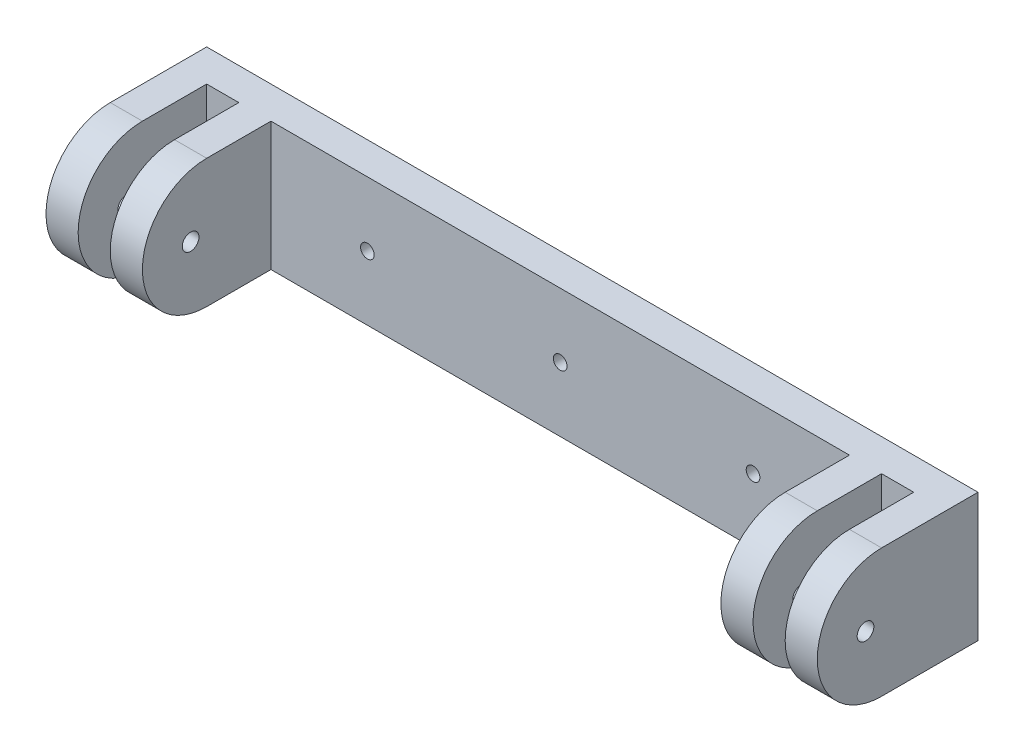
from build123d import *

# Parameters (mm, degrees)
SKETCH1_W           = 240
SKETCH1_H           = 40
BOSS_EXTRUDE1_DEPTH = 10
SKETCH2_W           = 20
SKETCH2_H           = 40
BOSS_EXTRUDE2_DEPTH = 240
SKETCH3_R           = 2.6
CUT_EXTRUDE1_DEPTH  = 300
SKETCH4_W           = 10
SKETCH4_H           = 40
SKETCH4_W_2         = 180
CUT_EXTRUDE2_DEPTH  = 300
SKETCH5_R           = 2.125
CUT_EXTRUDE3_DEPTH  = 300


with BuildPart() as part:
    # Sketch1 → Boss-Extrude1 (new body)
    with BuildSketch(Plane.XY):
        with Locations((120, 20)):
            Rectangle(SKETCH1_W, SKETCH1_H)
    extrude(amount=BOSS_EXTRUDE1_DEPTH)

    # Sketch2 → Boss-Extrude2 (add)
    with BuildSketch(Plane(origin=(240, 0, 0), x_dir=(0, 0, -1), z_dir=(1, 0, 0))):
        with Locations((-20, 20)):
            Rectangle(SKETCH2_W, SKETCH2_H)
        with BuildLine():
            Line((-30, 40), (-30, 0))
            ThreePointArc((-30, 0), (-50, 20), (-30, 40))
        make_face()
    extrude(amount=-BOSS_EXTRUDE2_DEPTH)

    # Sketch3 → Cut-Extrude1 (cut)
    with BuildSketch(Plane(origin=(240, 0, 0), x_dir=(0, 0, -1), z_dir=(1, 0, 0))):
        with Locations((-35, 20)):
            Circle(SKETCH3_R)
    extrude(amount=-CUT_EXTRUDE1_DEPTH, mode=Mode.SUBTRACT)

    # Sketch4 → Cut-Extrude2 (cut)
    with BuildSketch(Plane.XZ):
        with Locations((15, 30)):
            Rectangle(SKETCH4_W, SKETCH4_H)
        with Locations((120, 30)):
            Rectangle(SKETCH4_W_2, SKETCH4_H)
        with Locations((225, 30)):
            Rectangle(SKETCH4_W, SKETCH4_H)
    extrude(amount=-CUT_EXTRUDE2_DEPTH, mode=Mode.SUBTRACT)

    # Sketch5 → Cut-Extrude3 (cut)
    with BuildSketch(Plane(origin=(0, 0, 0), x_dir=(-1, 0, 0), z_dir=(0, 0, -1))):
        with Locations((-180, 20)):
            Circle(SKETCH5_R)
        with Locations((-120, 20)):
            Circle(SKETCH5_R)
        with Locations((-60, 20)):
            Circle(SKETCH5_R)
    extrude(amount=-CUT_EXTRUDE3_DEPTH, mode=Mode.SUBTRACT)


solid = part.part
